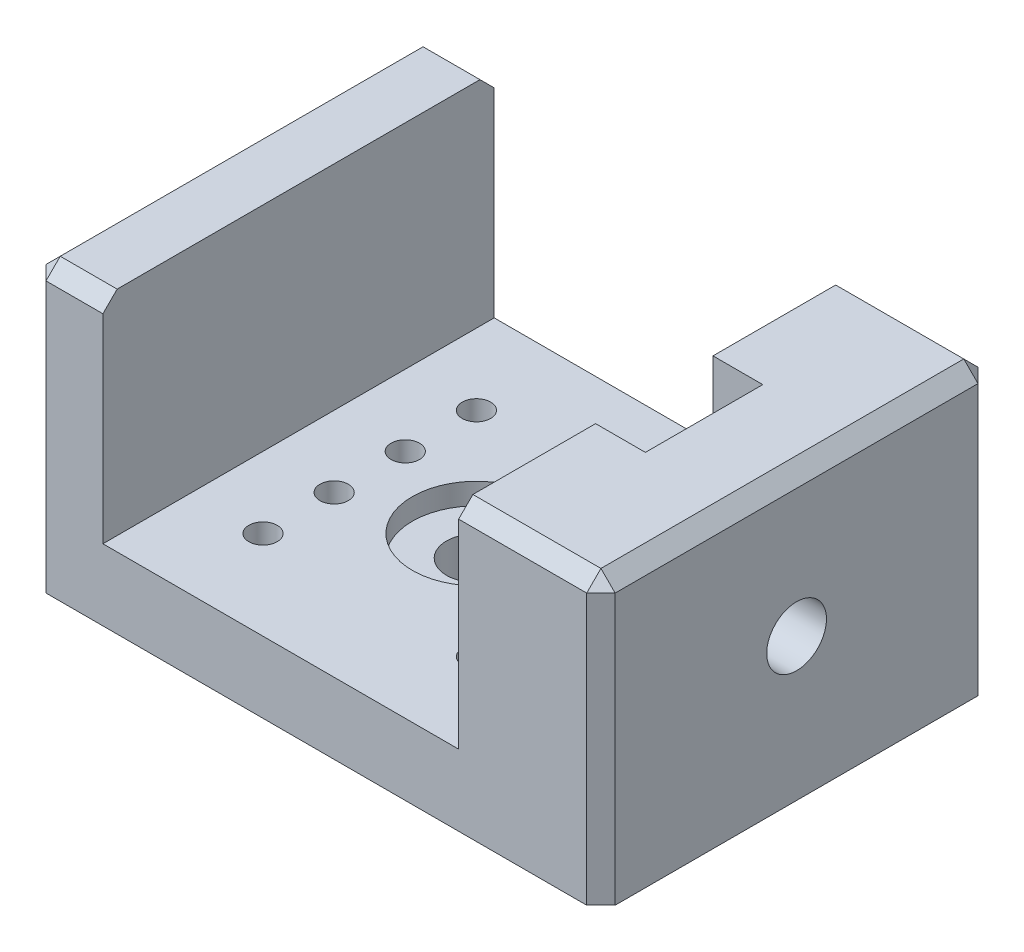
from build123d import *

# Parameters (mm, degrees)
BOSS_EXTRUDE1_DEPTH = 55
SKETCH2_R           = 2
CUT_EXTRUDE1_DEPTH  = 72.763500472
CUT_EXTRUDE2_DEPTH  = 3
SKETCH4_R           = 4.2
CUT_EXTRUDE3_DEPTH  = 72.763500472
SKETCH5_R           = 9
CUT_EXTRUDE4_DEPTH  = 3
SKETCH6_R           = 4.2
CUT_EXTRUDE5_DEPTH  = 10
SKETCH7_W           = 16.5
SKETCH7_H           = 30
CUT_EXTRUDE6_DEPTH  = 7
BOSS_EXTRUDE2_START = 10
SKETCH8_W           = 55
SKETCH8_H           = 40
SKETCH8_R           = 4.2
BOSS_EXTRUDE2_DEPTH = 10
CHAMFER1_SIZE       = 2


with BuildPart() as part:
    # Sketch1 → Boss-Extrude1 (new body)
    with BuildSketch(Plane.XY):
        Polygon((0, 0), (35, 0), (35, 40), (25, 40), (25, 10), (0, 10), (-25, 10), (-25, 40), (-35, 40), (-35, 0), align=None)
    extrude(amount=BOSS_EXTRUDE1_DEPTH)

    # Sketch2 → Cut-Extrude1 (cut, through all)
    with BuildSketch(Plane(origin=(0, 10, 0), x_dir=(1, 0, 0), z_dir=(0, 1, 0))):
        with Locations(Location((-15, -12.5, 0), (0, 0, 180))):
            Circle(SKETCH2_R)
        with Locations(Location((-15, -22.5, 0), (0, 0, 180))):
            Circle(SKETCH2_R)
        with Locations(Location((15, -12.5, 0), (0, 0, 180))):
            Circle(SKETCH2_R)
        with Locations(Location((15, -22.5, 0), (0, 0, 180))):
            Circle(SKETCH2_R)
        with Locations(Location((15, -32.5, 0), (0, 0, 180))):
            Circle(SKETCH2_R)
        with Locations(Location((-15, -32.5, 0), (0, 0, 180))):
            Circle(SKETCH2_R)
        with Locations(Location((-15, -42.5, 0), (0, 0, 180))):
            Circle(SKETCH2_R)
        with Locations(Location((15, -42.5, 0), (0, 0, 180))):
            Circle(SKETCH2_R)
    extrude(amount=-CUT_EXTRUDE1_DEPTH, mode=Mode.SUBTRACT)

    # Sketch3 → Cut-Extrude2 (cut)
    with BuildSketch(Plane.XZ):
        Polygon((-10.958548116, 12.5), (-12.979274058, 16), (-17.020725942, 16), (-19.041451884, 12.5), (-17.020725942, 9), (-12.979274058, 9), align=None)
        Polygon((-10.958548116, 22.5), (-12.979274058, 26), (-17.020725942, 26), (-19.041451884, 22.5), (-17.020725942, 19), (-12.979274058, 19), align=None)
        Polygon((-10.958548116, 32.5), (-12.979274058, 36), (-17.020725942, 36), (-19.041451884, 32.5), (-17.020725942, 29), (-12.979274058, 29), align=None)
        Polygon((-10.958548116, 42.5), (-12.979274058, 46), (-17.020725942, 46), (-19.041451884, 42.5), (-17.020725942, 39), (-12.979274058, 39), align=None)
        Polygon((19.041451884, 42.5), (17.020725942, 46), (12.979274058, 46), (10.958548116, 42.5), (12.979274058, 39), (17.020725942, 39), align=None)
        Polygon((19.041451884, 32.5), (17.020725942, 36), (12.979274058, 36), (10.958548116, 32.5), (12.979274058, 29), (17.020725942, 29), align=None)
        Polygon((19.041451884, 22.5), (17.020725942, 26), (12.979274058, 26), (10.958548116, 22.5), (12.979274058, 19), (17.020725942, 19), align=None)
        Polygon((19.041451884, 12.5), (17.020725942, 16), (12.979274058, 16), (10.958548116, 12.5), (12.979274058, 9), (17.020725942, 9), align=None)
    extrude(amount=-CUT_EXTRUDE2_DEPTH, mode=Mode.SUBTRACT)

    # Sketch4 → Cut-Extrude3 (cut, through all)
    with BuildSketch(Plane(origin=(0, 10, 0), x_dir=(1, 0, 0), z_dir=(0, 1, 0))):
        with Locations(Location((0, -27.5, 0), (0, 0, 180))):
            Circle(SKETCH4_R)
    extrude(amount=-CUT_EXTRUDE3_DEPTH, mode=Mode.SUBTRACT)

    # Sketch5 → Cut-Extrude4 (cut)
    with BuildSketch(Plane(origin=(0, 10, 0), x_dir=(1, 0, 0), z_dir=(0, 1, 0))):
        with Locations(Location((0, -27.5, 0), (0, 0, 180))):
            Circle(SKETCH5_R)
    extrude(amount=-CUT_EXTRUDE4_DEPTH, mode=Mode.SUBTRACT)

    # Sketch6 → Cut-Extrude5 (cut)
    with BuildSketch(Plane(origin=(35, 0, 0), x_dir=(0, 0, -1), z_dir=(1, 0, 0))):
        with Locations((-27.5, 20)):
            Circle(SKETCH6_R)
    extrude(amount=-CUT_EXTRUDE5_DEPTH, mode=Mode.SUBTRACT)

    # Sketch7 → Cut-Extrude6 (cut)
    with BuildSketch(Plane.ZY.offset(-25)):
        with Locations((27.5, 25)):
            Rectangle(SKETCH7_W, SKETCH7_H)
    extrude(amount=-CUT_EXTRUDE6_DEPTH, mode=Mode.SUBTRACT)

    # Sketch8 → Boss-Extrude2 (add)
    with BuildSketch(Plane(origin=(35, 0, 0), x_dir=(0, 0, -1), z_dir=(1, 0, 0)).offset(BOSS_EXTRUDE2_START)):
        with Locations((-27.5, 20)):
            Rectangle(SKETCH8_W, SKETCH8_H)
        with Locations((-27.5, 20)):
            Circle(SKETCH8_R, mode=Mode.SUBTRACT)
    extrude(amount=-BOSS_EXTRUDE2_DEPTH)

    # Chamfer1
    chamfer1_edges = [part.edges().sort_by_distance(p)[0] for p in [
        (-35, 20, 0),
        (-30, 40, 0),
        (35, 40, 0),
        (-35, 40, 27.5),
        (45, 20, 0),
        (45, 40, 27.5),
        (45, 20, 55),
        (-30, 40, 55),
        (-35, 20, 55),
        (35, 40, 55),
    ]]
    chamfer(chamfer1_edges, length=CHAMFER1_SIZE)


solid = part.part
